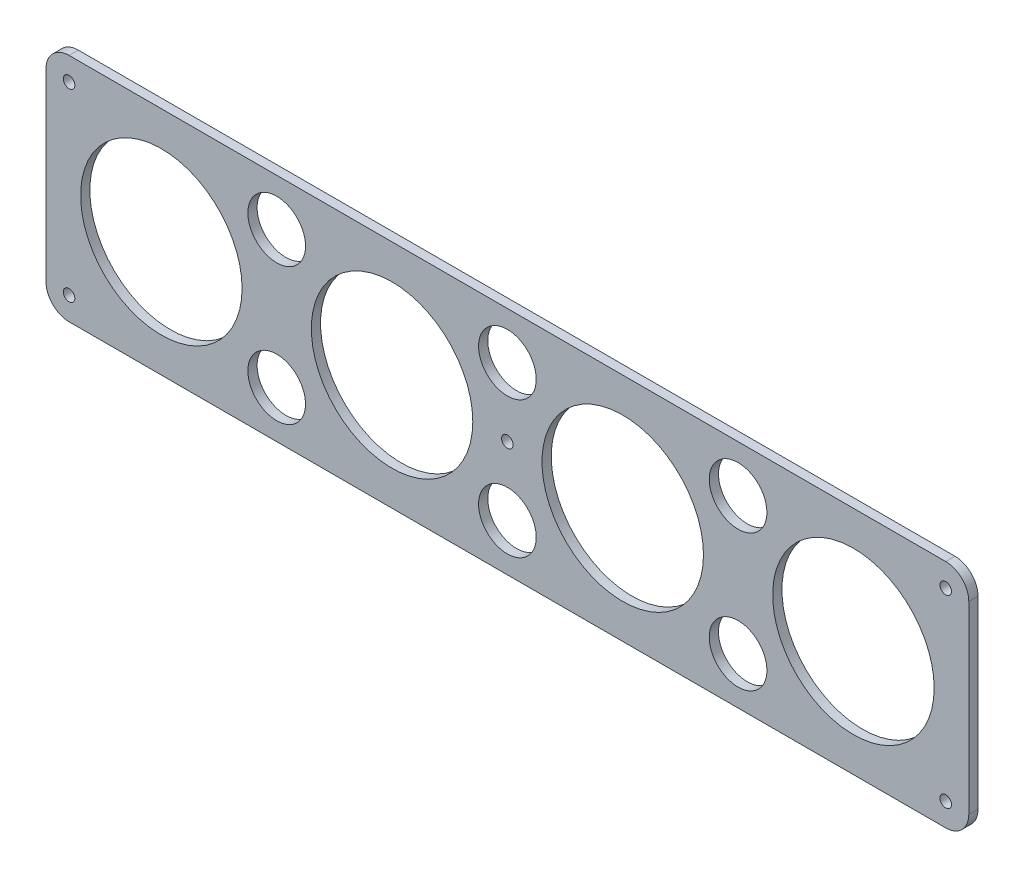
from build123d import *

# Parameters (mm, degrees)
SKETCH1_W           = 400
SKETCH1_H           = 100
SKETCH1_R           = 35
SKETCH1_R_2         = 12.5
SKETCH1_R_3         = 2.5
BOSS_EXTRUDE1_DEPTH = 4
FILLET1_R           = 10


with BuildPart() as part:
    # Sketch1 → Boss-Extrude1 (new body)
    with BuildSketch(Plane.XY):
        with Locations((200, 50)):
            Rectangle(SKETCH1_W, SKETCH1_H)
        with Locations((50, 50)):
            Circle(SKETCH1_R, mode=Mode.SUBTRACT)
        with Locations((150, 50)):
            Circle(SKETCH1_R, mode=Mode.SUBTRACT)
        with Locations((250, 50)):
            Circle(SKETCH1_R, mode=Mode.SUBTRACT)
        with Locations((350, 50)):
            Circle(SKETCH1_R, mode=Mode.SUBTRACT)
        with Locations((100, 79.642297689)):
            Circle(SKETCH1_R_2, mode=Mode.SUBTRACT)
        with Locations(Location((100, 20.357702311, 0), (0, 0, 180))):
            Circle(SKETCH1_R_2, mode=Mode.SUBTRACT)
        with Locations(Location((200, 20.357702311, 0), (0, 0, 180))):
            Circle(SKETCH1_R_2, mode=Mode.SUBTRACT)
        with Locations((200, 79.642297689)):
            Circle(SKETCH1_R_2, mode=Mode.SUBTRACT)
        with Locations(Location((300, 20.357702311, 0), (0, 0, 180))):
            Circle(SKETCH1_R_2, mode=Mode.SUBTRACT)
        with Locations((300, 79.642297689)):
            Circle(SKETCH1_R_2, mode=Mode.SUBTRACT)
        with Locations((10, 10)):
            Circle(SKETCH1_R_3, mode=Mode.SUBTRACT)
        with Locations(Location((10, 90, 0), (0, 0, 180))):
            Circle(SKETCH1_R_3, mode=Mode.SUBTRACT)
        with Locations((390, 90)):
            Circle(SKETCH1_R_3, mode=Mode.SUBTRACT)
        with Locations(Location((390, 10, 0), (0, 0, 180))):
            Circle(SKETCH1_R_3, mode=Mode.SUBTRACT)
        with Locations((200, 50)):
            Circle(SKETCH1_R_3, mode=Mode.SUBTRACT)
    extrude(amount=BOSS_EXTRUDE1_DEPTH)

    # Fillet1
    fillet1_edges = [part.edges().sort_by_distance(p)[0] for p in [
        (0, 100, 2),
        (400, 100, 2),
        (400, 0, 2),
        (0, 0, 2),
    ]]
    fillet(fillet1_edges, radius=FILLET1_R)


solid = part.part
